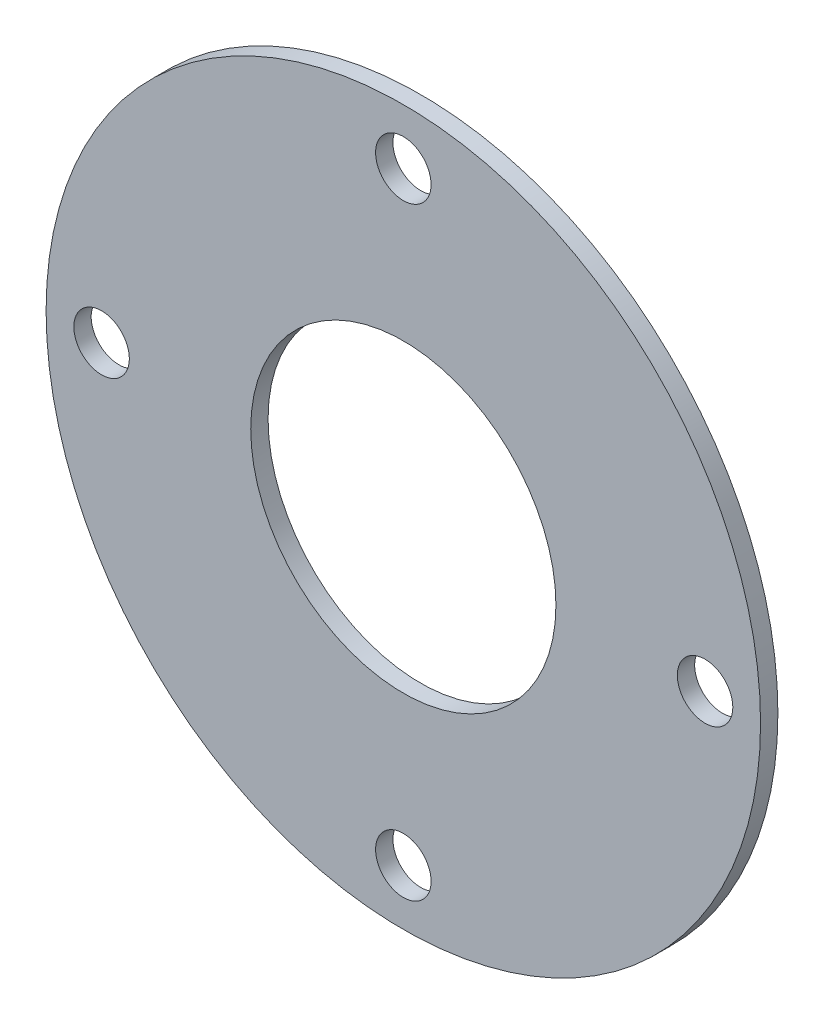
from build123d import *

# Parameters (mm, degrees)
CARRIER_REAR_START  = 27
SKETCH_1_R          = 51.5
SKETCH_1_R_2        = 22
CARRIER_REAR_DEPTH  = 2.5
SKETCH_2_R          = 4
THROUGH_HOLES_DEPTH = 100


with BuildPart() as part:
    # Эскиз1 → Carrier_rear (new body)
    with BuildSketch(Plane.XY.offset(CARRIER_REAR_START)):
        Circle(SKETCH_1_R)
        Circle(SKETCH_1_R_2, mode=Mode.SUBTRACT)
    extrude(amount=CARRIER_REAR_DEPTH)

    # Эскиз2 → Through_holes (cut, symmetric)
    with BuildSketch(Plane.XY):
        with Locations((43.5, 0)):
            Circle(SKETCH_2_R)
        with Locations((0, 43.5)):
            Circle(SKETCH_2_R)
        with Locations((-43.5, 0)):
            Circle(SKETCH_2_R)
        with Locations((0, -43.5)):
            Circle(SKETCH_2_R)
    extrude(amount=THROUGH_HOLES_DEPTH, both=True, mode=Mode.SUBTRACT)


solid = part.part
